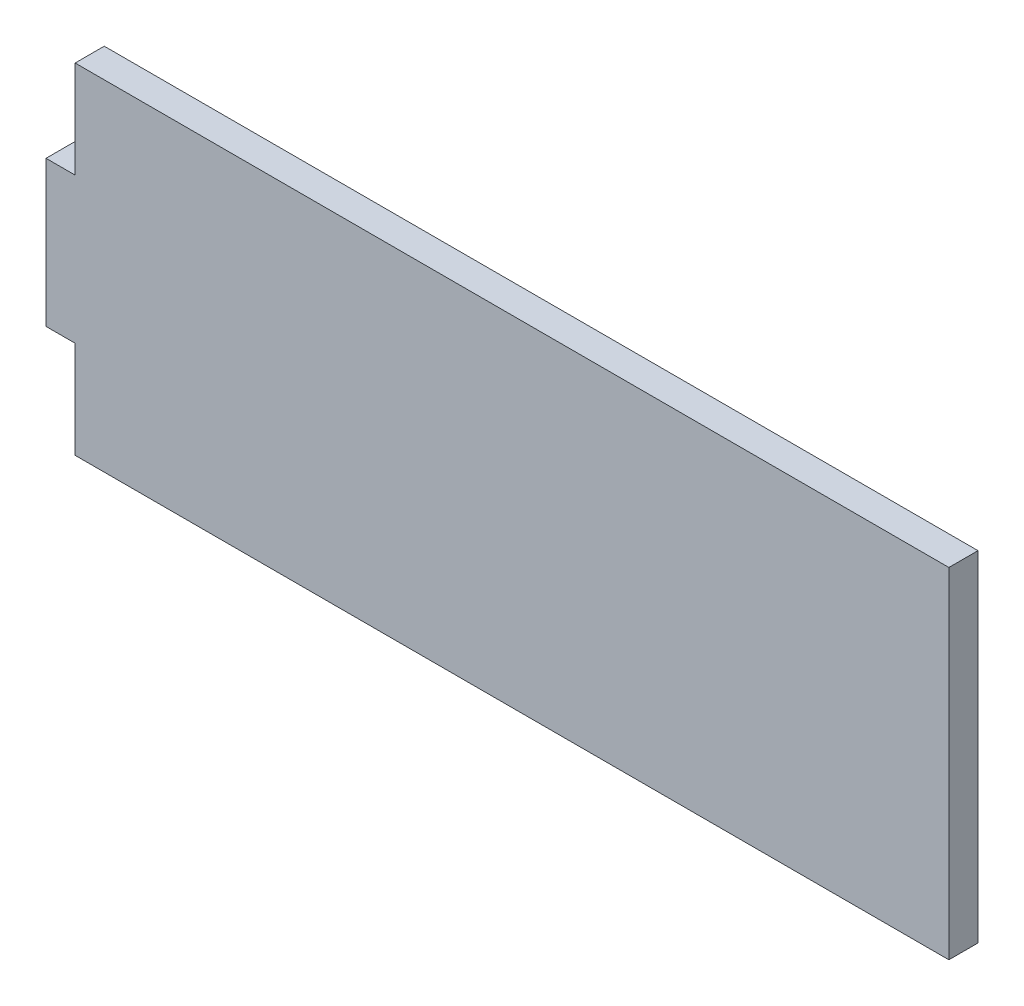
from build123d import *

# Parameters (mm, degrees)
SKETCH1_W           = 90
SKETCH1_H           = 35
SKETCH1_W_2         = 3
SKETCH1_H_2         = 15
BOSS_EXTRUDE1_DEPTH = 1.5


with BuildPart() as part:
    # Sketch1 → Boss-Extrude1 (new, symmetric)
    with BuildSketch(Plane.XY):
        Rectangle(SKETCH1_W, SKETCH1_H)
        with Locations((-46.5, 0)):
            Rectangle(SKETCH1_W_2, SKETCH1_H_2)
    extrude(amount=BOSS_EXTRUDE1_DEPTH, both=True)


solid = part.part
